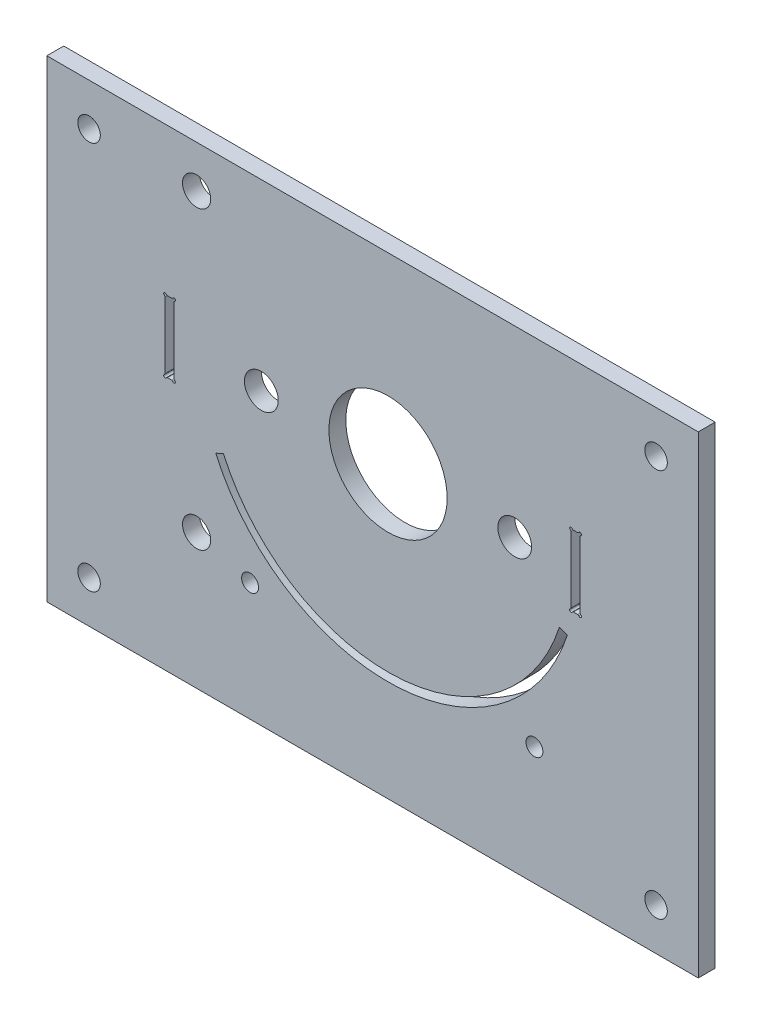
from build123d import *

# Parameters (mm, degrees)
SKETCH2_R                  = 21
SKETCH2_W                  = 3.2
SKETCH2_H                  = 25.2
BOSS_EXTRUDE1_DEPTH        = 3
F_10_0_10_DIAMETER_HOLE1_D = 10
F_8_0_8_DIAMETER_HOLE1_D   = 8
F_12_0_12_DIAMETER_HOLE1_D = 12
CUT_EXTRUDE1_DEPTH         = 160.1679616
CUT_EXTRUDE1_DEPTH_BACK    = 160.1679616
SKETCH19_R                 = 0.5
CUT_EXTRUDE2_DEPTH         = 160.1679616
FILLET1_R                  = 0.5
F_6_0_6_DIAMETER_HOLE1_D   = 6


with BuildPart() as part:
    # Sketch2 → Boss-Extrude1 (new, symmetric)
    with BuildSketch(Plane.XY):
        Polygon((-68, 65), (95.2, 65), (110.2, 65), (110.2, -103), (0, -103), (-121.2, -103), (-121.2, 65), (-106.2, 65), align=None)
        Circle(SKETCH2_R, mode=Mode.SUBTRACT)
        with Locations((-77.6, 0)):
            Rectangle(SKETCH2_W, SKETCH2_H, mode=Mode.SUBTRACT)
        with Locations((66.6, 0)):
            Rectangle(SKETCH2_W, SKETCH2_H, mode=Mode.SUBTRACT)
    extrude(amount=BOSS_EXTRUDE1_DEPTH, both=True)

    # Ø10.0 (10) Diameter Hole1 (through all)
    with Locations(Plane.XY.offset(3)):
        with Locations((-68, 50), (-68, -55)):
            Hole(F_10_0_10_DIAMETER_HOLE1_D / 2)

    # Ø8.0 (8) Diameter Hole1 (through all)
    with Locations(Plane.XY.offset(3)):
        with Locations((-106.2, 50), (-106.2, -88), (95.2, -88), (95.2, 50)):
            Hole(F_8_0_8_DIAMETER_HOLE1_D / 2)

    # Ø12.0 (12) Diameter Hole1 (through all)
    with Locations(Plane.XY.offset(3)):
        with Locations((-45, 0), (45, 0)):
            Hole(F_12_0_12_DIAMETER_HOLE1_D / 2)

    # Sketch18 → Cut-Extrude1 (cut, two sides: drawn at the far end of the back side and taken through both)
    with BuildSketch(Plane(origin=(0, 0, -3), x_dir=(-1, 0, 0), z_dir=(0, 0, -1)).offset(-CUT_EXTRUDE1_DEPTH_BACK)):
        with BuildLine():
            Line((-60.867617043, -19.77708764), (-63.720786592, -20.704138623))
            ThreePointArc((-63.720786592, -20.704138623), (-3.506509068, -66.908178829), (61.207545662, -27.251355086))
            Line((61.207545662, -27.251355086), (58.466909289, -26.031145157))
            ThreePointArc((58.466909289, -26.031145157), (-3.3495012, -63.912290224), (-60.867617043, -19.77708764))
        make_face()
    extrude(amount=CUT_EXTRUDE1_DEPTH + CUT_EXTRUDE1_DEPTH_BACK, mode=Mode.SUBTRACT)

    # Sketch19 → Cut-Extrude2 (cut, through all)
    with BuildSketch(Plane(origin=(0, 0, -3), x_dir=(-1, 0, 0), z_dir=(0, 0, -1))):
        with Locations((-65, -12.6)):
            Circle(SKETCH19_R)
        with Locations((-68.2, -12.6)):
            Circle(SKETCH19_R)
        with Locations((-68.2, 12.6)):
            Circle(SKETCH19_R)
        with Locations((-65, 12.6)):
            Circle(SKETCH19_R)
        with Locations((79.2, -12.6)):
            Circle(SKETCH19_R)
        with Locations((76, -12.6)):
            Circle(SKETCH19_R)
        with Locations((79.2, 12.6)):
            Circle(SKETCH19_R)
        with Locations((76, 12.6)):
            Circle(SKETCH19_R)
    extrude(amount=-CUT_EXTRUDE2_DEPTH, mode=Mode.SUBTRACT)

    # Fillet1
    fillet1_edges = [part.edges().sort_by_distance(p)[0] for p in [
        (68.2, 12.1, 0),
        (68.2, -12.1, 0),
        (65.5, -12.6, 0),
        (65, 12.1, 0),
        (-76, -12.1, 0),
        (-76, 12.1, 0),
        (-78.7, -12.6, 0),
        (-79.2, 12.1, 0),
        (67.7, -12.6, 0),
        (67.7, 12.6, 0),
        (65.5, 12.6, 0),
        (-79.2, -12.1, 0),
        (-76.5, 12.6, 0),
        (-78.7, 12.6, 0),
        (-76.5, -12.6, 0),
        (65, -12.1, 0),
    ]]
    fillet(fillet1_edges, radius=FILLET1_R)

    # Ø6.0 (6) Diameter Hole1 (through all)
    with Locations(Plane.XY.offset(3)):
        with Locations((-49, -61), (52, -61)):
            Hole(F_6_0_6_DIAMETER_HOLE1_D / 2)


solid = part.part
